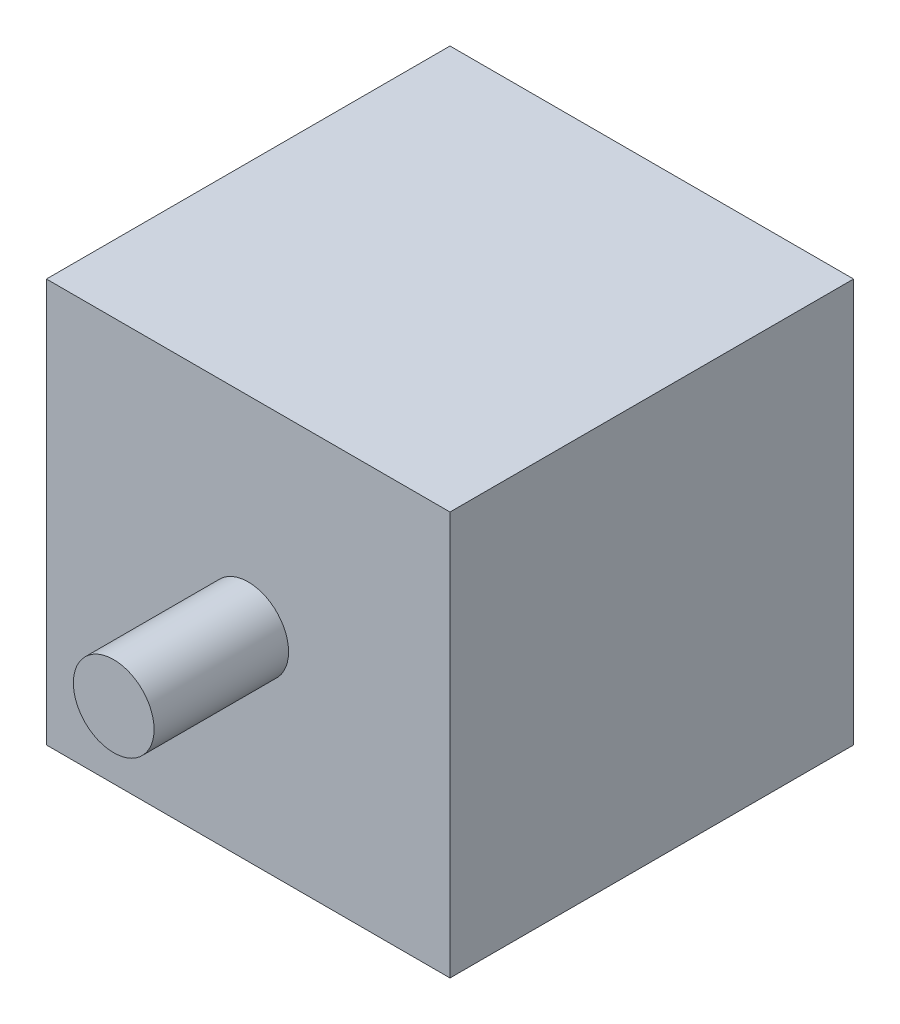
from build123d import *

# Parameters (mm, degrees)
SKETCH_2_W      = 15
SKETCH_2_H      = 15
EXTRUDE_1_DEPTH = 15
SKETCH_3_R      = 1.5
EXTRUDE_2_DEPTH = 5


with BuildPart() as part:
    # 草图2 → 凸台-拉伸1 (new body)
    with BuildSketch(Plane.XY):
        Rectangle(SKETCH_2_W, SKETCH_2_H)
    extrude(amount=EXTRUDE_1_DEPTH)

    # 草图3 → 凸台-拉伸2 (add)
    with BuildSketch(Plane.XY.offset(15)):
        Circle(SKETCH_3_R)
    extrude(amount=EXTRUDE_2_DEPTH)


solid = part.part
